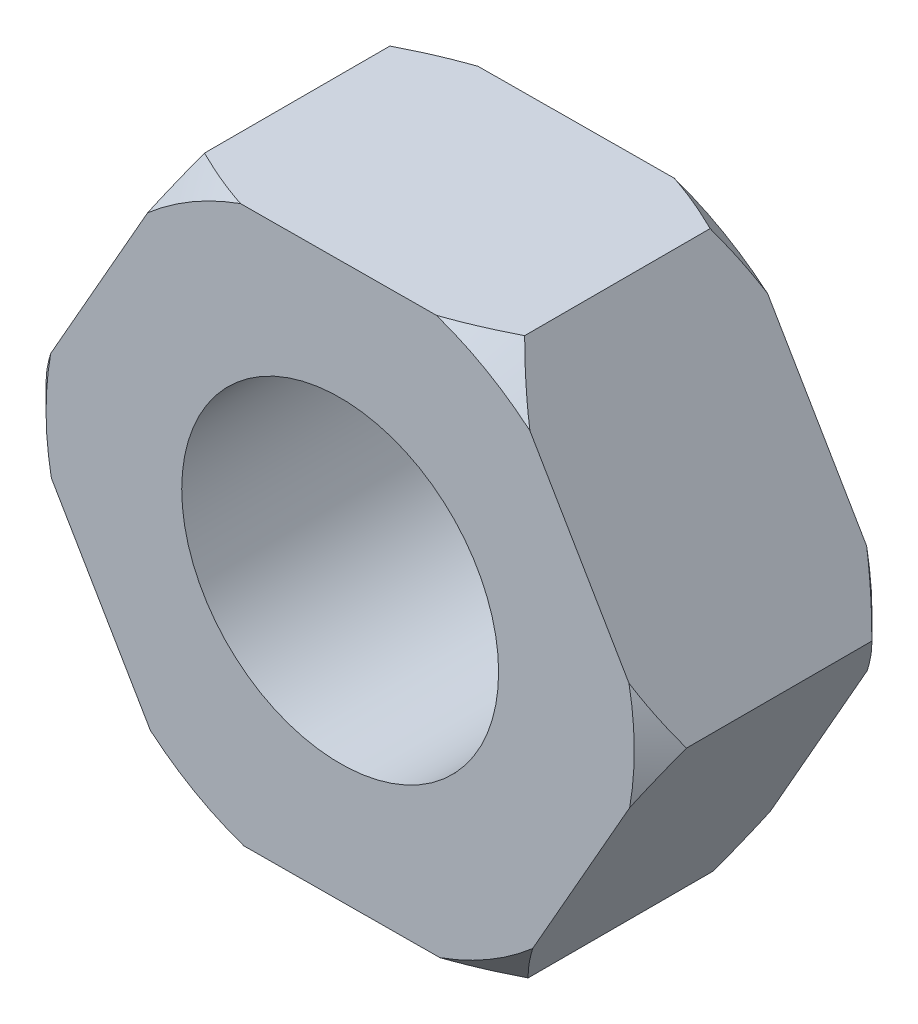
from build123d import *

# Parameters (mm, degrees)
SKETCH1_R           = 10
BOSS_EXTRUDE1_DEPTH = 15


with BuildPart() as part:
    # Sketch1 → Boss-Extrude1 (new body)
    with BuildSketch(Plane.XY):
        Polygon((9.995276011, 17.562112367), (-10.211597448, 17.437219127), (-20.20687346, -0.12489324), (-9.995276011, -17.562112367), (10.211597448, -17.437219127), (20.20687346, 0.12489324), align=None)
        Circle(SKETCH1_R, mode=Mode.SUBTRACT)
    extrude(amount=BOSS_EXTRUDE1_DEPTH)

    # Sketch2 → Cut-Revolve1 (revolve, cut)
    with BuildSketch(Plane(origin=(0, 0, 0), x_dir=(1, 0, 0), z_dir=(0, 1, 0))):
        Polygon((17.560689011, 1), (21.20687346, -2.646184449), (21.20687346, 1), align=None)
        Polygon((21.20687346, -16), (17.560689011, -16), (21.20687346, -12.353815551), align=None)
    revolve(axis=Axis((0, 0, 0), (0, 0, -1)), mode=Mode.SUBTRACT)


solid = part.part
